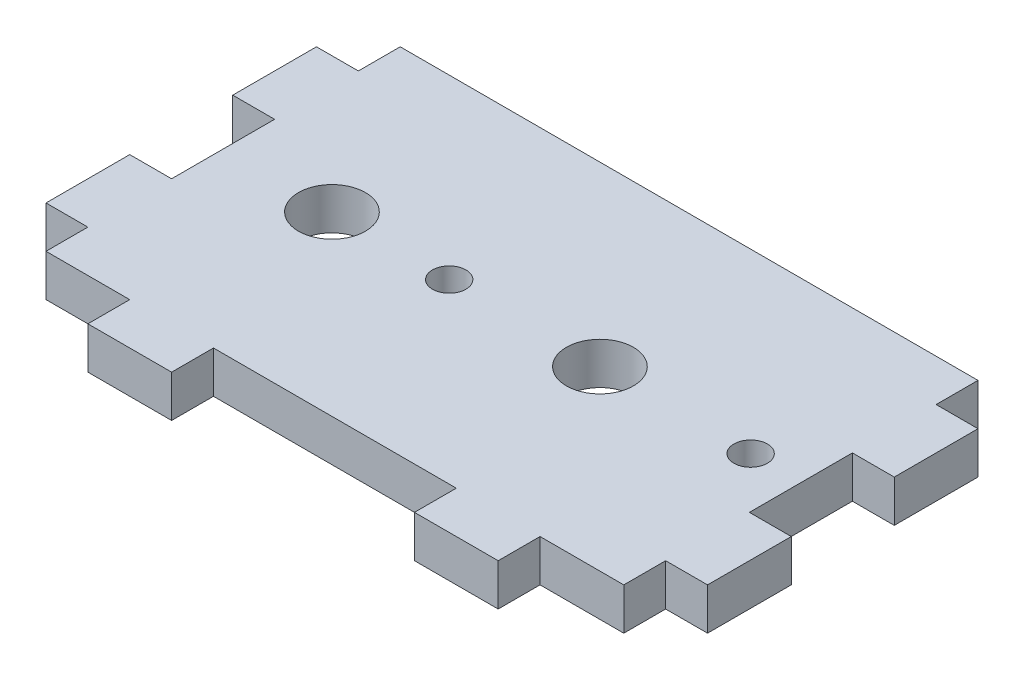
from build123d import *

# Parameters (mm, degrees)
SKETCH_1_R      = 4
SKETCH_1_R_2    = 2
EXTRUDE_1_DEPTH = 5


with BuildPart() as part:
    # 草图1 → 凸台-拉伸1 (new body)
    with BuildSketch(Plane(origin=(0, 0, 0), x_dir=(1, 0, 0), z_dir=(0, 1, 0))):
        Polygon((-34.5, 21.15), (34.5, 21.15), (34.5, 16.15), (39.5, 16.15), (39.5, 6.15), (34.5, 6.15), (34.5, -6.15), (39.5, -6.15), (39.5, -16.15), (34.5, -16.15), (34.5, -21.15), (24.5, -21.15), (24.5, -26.15), (14.5, -26.15), (14.5, -21.15), (-14.5, -21.15), (-14.5, -26.15), (-24.5, -26.15), (-24.5, -21.15), (-34.5, -21.15), (-34.5, -16.15), (-39.5, -16.15), (-39.5, -6.15), (-34.5, -6.15), (-34.5, 6.15), (-39.5, 6.15), (-39.5, 16.15), (-34.5, 16.15), align=None)
        with Locations(Location((10.5, 0, 0), (0, 0, 270))):
            Circle(SKETCH_1_R, mode=Mode.SUBTRACT)
        with Locations(Location((-21.5, 0, 0), (0, 0, 270))):
            Circle(SKETCH_1_R, mode=Mode.SUBTRACT)
        with Locations(Location((-7.5, 0, 0), (0, 0, 270))):
            Circle(SKETCH_1_R_2, mode=Mode.SUBTRACT)
        with Locations(Location((28.5, 0, 0), (0, 0, 270))):
            Circle(SKETCH_1_R_2, mode=Mode.SUBTRACT)
    extrude(amount=EXTRUDE_1_DEPTH)


solid = part.part
